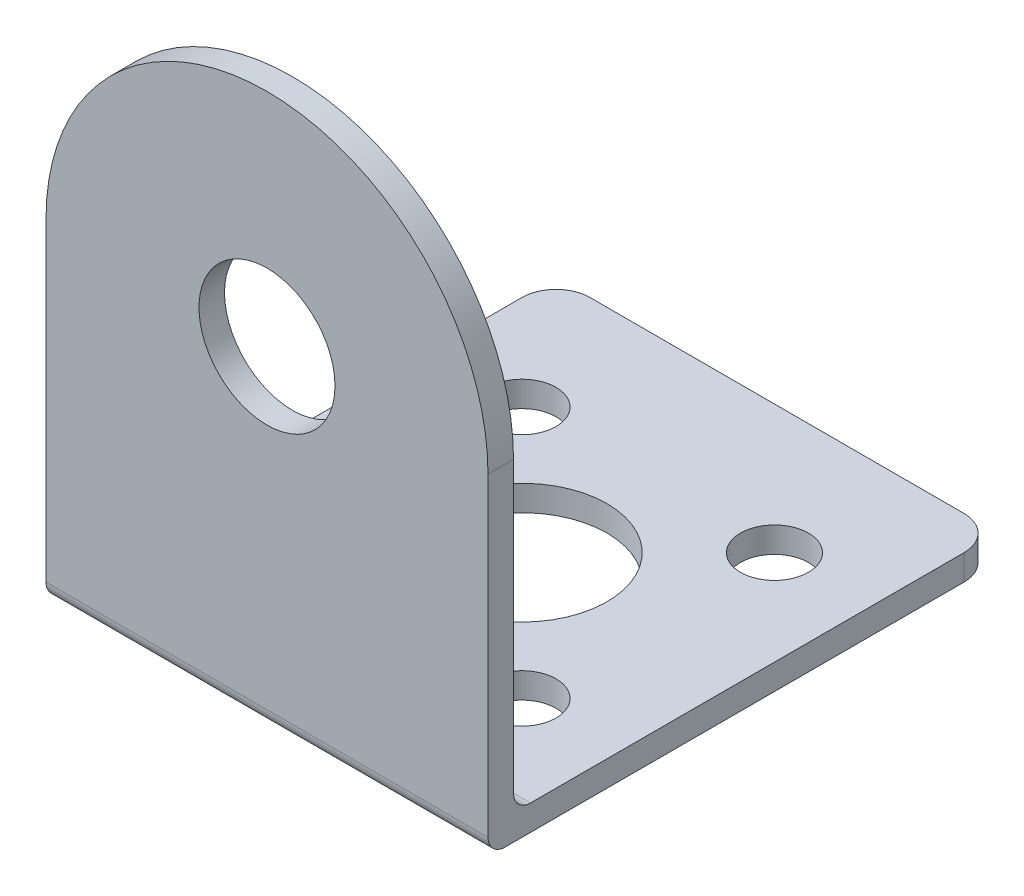
from build123d import *

# Parameters (mm, degrees)
SKETCH1_W           = 26
SKETCH1_H           = 30
BOSS_EXTRUDE1_DEPTH = 1.5
BOSS_EXTRUDE2_DEPTH = 1.5
SKETCH4_R           = 4
CUT_EXTRUDE1_DEPTH  = 47.100433837
FILLET1_R           = 1
FILLET2_R           = 2
SKETCH5_R           = 5
SKETCH5_R_2         = 2
CUT_EXTRUDE2_DEPTH  = 39.082148049


with BuildPart() as part:
    # Sketch1 → Boss-Extrude1 (new body)
    with BuildSketch(Plane(origin=(0, 0, 0), x_dir=(1, 0, 0), z_dir=(0, 1, 0))):
        Rectangle(SKETCH1_W, SKETCH1_H)
    extrude(amount=BOSS_EXTRUDE1_DEPTH)

    # Sketch3 → Boss-Extrude2 (add)
    with BuildSketch(Plane.XY.offset(15)):
        with BuildLine():
            Line((-13, 1.5), (-13, 19.5))
            ThreePointArc((-13, 19.5), (0, 32.5), (13, 19.5))
            Line((13, 19.5), (13, 1.5))
            Line((13, 1.5), (-13, 1.5))
        make_face()
    extrude(amount=-BOSS_EXTRUDE2_DEPTH)

    # Sketch4 → Cut-Extrude1 (cut, through all)
    with BuildSketch(Plane.XY.offset(15)):
        with Locations((0, 19.5)):
            Circle(SKETCH4_R)
    extrude(amount=-CUT_EXTRUDE1_DEPTH, mode=Mode.SUBTRACT)

    # Fillet1
    fillet1_edges = [part.edges().sort_by_distance(p)[0] for p in [
        (0, 1.5, 13.5),
        (0, 0, 15),
    ]]
    fillet(fillet1_edges, radius=FILLET1_R)

    # Fillet2
    fillet2_edges = [part.edges().sort_by_distance(p)[0] for p in [
        (-13, 0.75, -15),
        (13, 0.75, -15),
    ]]
    fillet(fillet2_edges, radius=FILLET2_R)

    # Sketch5 → Cut-Extrude2 (cut, through all)
    with BuildSketch(Plane.XZ):
        with Locations(Location((0, 0, 0), (0, 0, 270))):
            Circle(SKETCH5_R)
        with Locations(Location((7.424621202, 7.424621202, 0), (0, 0, 270))):
            Circle(SKETCH5_R_2)
        with Locations(Location((-7.424621202, -7.424621202, 0), (0, 0, 270))):
            Circle(SKETCH5_R_2)
        with Locations(Location((-7.424621202, 7.424621202, 0), (0, 0, 270))):
            Circle(SKETCH5_R_2)
        with Locations(Location((7.424621202, -7.424621202, 0), (0, 0, 270))):
            Circle(SKETCH5_R_2)
    extrude(amount=-CUT_EXTRUDE2_DEPTH, mode=Mode.SUBTRACT)


solid = part.part
